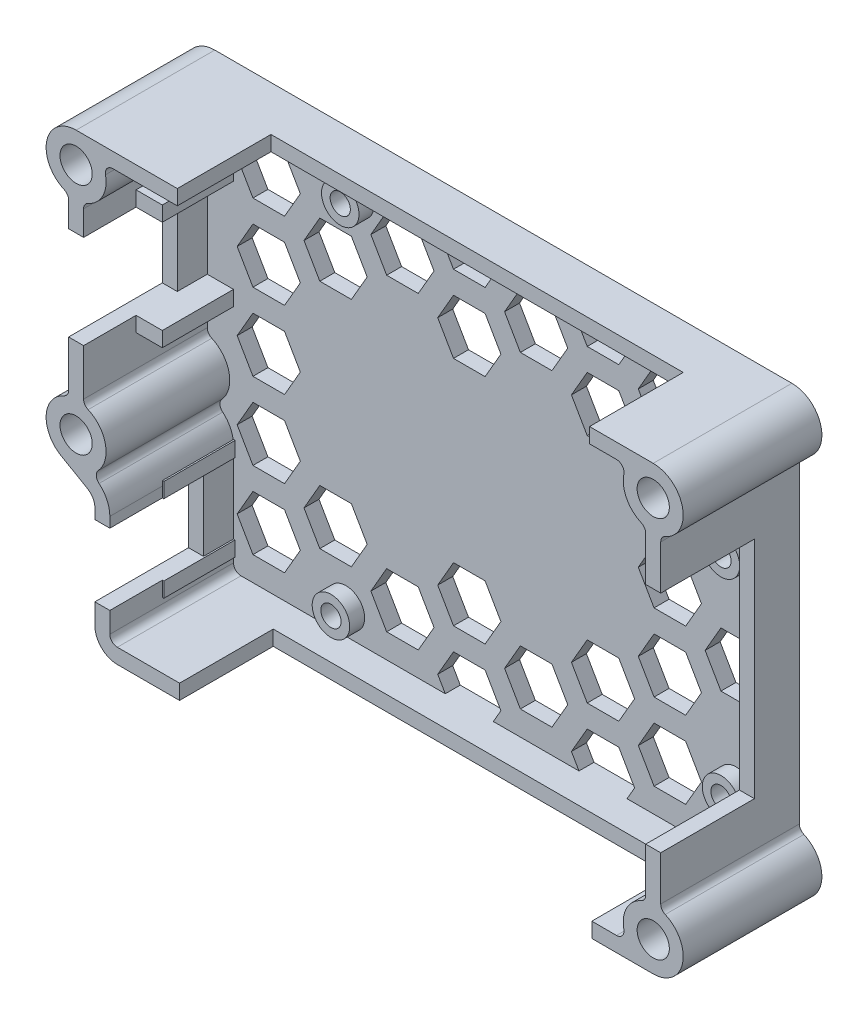
from build123d import *

# Parameters (mm, degrees)
ESQUISSE2_R             = 2.15
BOSS_EXTRU_1_DEPTH      = 2
ESQUISSE3_R             = 2.15
BOSS_EXTRU_2_DEPTH      = 16.5
ESQUISSE4_R             = 2.5
ESQUISSE4_R_2           = 1.35
BOSS_EXTRU_3_DEPTH      = 2
ESQUISSE6_W             = 2
ESQUISSE6_H             = 12.5
ESQUISSE6_H_2           = 9.5
ENL_V_MAT_EXTRU_1_DEPTH = 12.5
ESQUISSE7_W             = 3.5
ESQUISSE7_H             = 2
ESQUISSE7_W_2           = 0.2
BOSS_EXTRU_4_DEPTH      = 9.5
ENL_V_MAT_EXTRU_2_DEPTH = 55.333705929


with BuildPart() as part:
    # Esquisse2 → Boss.-Extru.1 (new body)
    with BuildSketch(Plane.XY):
        with BuildLine():
            ThreePointArc((-40.14, -1.999090834), (-42.533720464, -5.441104847), (-40.54, -9.129253005))
            Line((-40.54, -9.129253005), (-37.04, -11.149978947))
            ThreePointArc((-37.04, -11.149978947), (-36.307949192, -11.882029755), (-36.04, -12.882029755))
            Line((-36.04, -12.882029755), (-36.04, -26.5))
            ThreePointArc((-36.04, -26.5), (-35.161320344, -28.621320344), (-33.04, -29.5))
            Line((-33.04, -29.5), (38.46, -29.5))
            ThreePointArc((38.46, -29.5), (42.375625252, -26.317238575), (40.06, -21.833939444))
            ThreePointArc((40.06, -21.833939444), (39.623339973, -21.465146863), (39.46, -20.917424305))
            Line((39.46, -20.917424305), (39.46, 20.917424305))
            ThreePointArc((39.46, 20.917424305), (39.623339973, 21.465146863), (40.06, 21.833939444))
            ThreePointArc((40.06, 21.833939444), (42.375625252, 26.317238575), (38.46, 29.5))
            Line((38.46, 29.5), (-38.54, 29.5))
            ThreePointArc((-38.54, 29.5), (-42.455625252, 26.317238575), (-40.14, 21.833939444))
            ThreePointArc((-40.14, 21.833939444), (-39.703339973, 21.465146863), (-39.54, 20.917424305))
            Line((-39.54, 20.917424305), (-39.54, -1.082575695))
            ThreePointArc((-39.54, -1.082575695), (-39.703339973, -1.630298252), (-40.14, -1.999090834))
        make_face()
        with Locations((-38.54, -5.66515139)):
            Circle(ESQUISSE2_R, mode=Mode.SUBTRACT)
        with Locations((38.46, -25.5)):
            Circle(ESQUISSE2_R, mode=Mode.SUBTRACT)
        with Locations((-38.54, 25.5)):
            Circle(ESQUISSE2_R, mode=Mode.SUBTRACT)
        with Locations((38.46, 25.5)):
            Circle(ESQUISSE2_R, mode=Mode.SUBTRACT)
    extrude(amount=BOSS_EXTRU_1_DEPTH)

    # Esquisse3 → Boss.-Extru.2 (add)
    with BuildSketch(Plane.XY.offset(2)):
        with BuildLine():
            ThreePointArc((-40.14, 21.833939444), (-39.703339973, 21.465146863), (-39.54, 20.917424305))
            Line((-39.54, 20.917424305), (-39.54, -1.082575695))
            ThreePointArc((-39.54, -1.082575695), (-39.703339973, -1.630298252), (-40.14, -1.999090834))
            ThreePointArc((-40.14, -1.999090834), (-42.533720464, -5.441104847), (-40.54, -9.129253005))
            Line((-40.54, -9.129253005), (-37.04, -11.149978947))
            ThreePointArc((-37.04, -11.149978947), (-36.307949192, -11.882029755), (-36.04, -12.882029755))
            Line((-36.04, -12.882029755), (-36.04, -26.5))
            ThreePointArc((-36.04, -26.5), (-35.161320344, -28.621320344), (-33.04, -29.5))
            Line((-33.04, -29.5), (38.46, -29.5))
            ThreePointArc((38.46, -29.5), (42.375625252, -26.317238575), (40.06, -21.833939444))
            ThreePointArc((40.06, -21.833939444), (39.623339973, -21.465146863), (39.46, -20.917424305))
            Line((39.46, -20.917424305), (39.46, 20.917424305))
            ThreePointArc((39.46, 20.917424305), (39.623339973, 21.465146863), (40.06, 21.833939444))
            ThreePointArc((40.06, 21.833939444), (42.375625252, 26.317238575), (38.46, 29.5))
            Line((38.46, 29.5), (-38.54, 29.5))
            ThreePointArc((-38.54, 29.5), (-42.455625252, 26.317238575), (-40.14, 21.833939444))
        make_face()
        with Locations((-38.54, -5.66515139)):
            Circle(ESQUISSE3_R, mode=Mode.SUBTRACT)
        with Locations((38.46, -25.5)):
            Circle(ESQUISSE3_R, mode=Mode.SUBTRACT)
        with Locations((-38.54, 25.5)):
            Circle(ESQUISSE3_R, mode=Mode.SUBTRACT)
        with BuildLine():
            Line((-37.54, -1.082575695), (-37.54, 20.917424305))
            ThreePointArc((-37.54, 20.917424305), (-37.376660027, 21.465146863), (-36.94, 21.833939444))
            ThreePointArc((-36.94, 21.833939444), (-34.990102664, 23.656571426), (-34.620816412, 26.3))
            ThreePointArc((-34.620816412, 26.3), (-34.415617184, 27.132455532), (-33.641020514, 27.5))
            Line((-33.641020514, 27.5), (33.561020514, 27.5))
            ThreePointArc((33.561020514, 27.5), (34.335617184, 27.132455532), (34.540816412, 26.3))
            ThreePointArc((34.540816412, 26.3), (34.910102664, 23.656571426), (36.86, 21.833939444))
            ThreePointArc((36.86, 21.833939444), (37.296660027, 21.465146863), (37.46, 20.917424305))
            Line((37.46, 20.917424305), (37.46, -20.917424305))
            ThreePointArc((37.46, -20.917424305), (37.296660027, -21.465146863), (36.86, -21.833939444))
            ThreePointArc((36.86, -21.833939444), (34.910102664, -23.656571426), (34.540816412, -26.3))
            ThreePointArc((34.540816412, -26.3), (34.335617184, -27.132455532), (33.561020514, -27.5))
            Line((33.561020514, -27.5), (5.406709341, -27.5))
            Line((5.406709341, -27.5), (-33.04, -27.5))
            ThreePointArc((-33.04, -27.5), (-33.747106781, -27.207106781), (-34.04, -26.5))
            Line((-34.04, -26.5), (-34.04, -12.882029755))
            ThreePointArc((-34.04, -12.882029755), (-34.419216149, -11.182052019), (-35.484962152, -9.804403788))
            ThreePointArc((-35.484962152, -9.804403788), (-35.843811295, -9.104113647), (-35.584962152, -8.361028115))
            ThreePointArc((-35.584962152, -8.361028115), (-34.627755895, -4.83187709), (-36.94, -1.999090834))
            ThreePointArc((-36.94, -1.999090834), (-37.376660027, -1.630298252), (-37.54, -1.082575695))
        make_face(mode=Mode.SUBTRACT)
        with Locations((38.46, 25.5)):
            Circle(ESQUISSE3_R, mode=Mode.SUBTRACT)
    extrude(amount=BOSS_EXTRU_2_DEPTH)

    # Esquisse4 → Boss.-Extru.3 (add)
    # profile 1 of 4: a face of its own
    with BuildSketch(Plane.XY.offset(2)):
        with Locations((-17.8, 24.13)):
            Circle(ESQUISSE4_R)
        with Locations((-17.8, 24.13)):
            Circle(ESQUISSE4_R_2, mode=Mode.SUBTRACT)
    # profile 2 of 4: a face of its own
    with BuildSketch(Plane.XY.offset(2)):
        with Locations((-19.04, -24.13)):
            Circle(ESQUISSE4_R)
        with Locations((-19.04, -24.13)):
            Circle(ESQUISSE4_R_2, mode=Mode.SUBTRACT)
    # profile 3 of 4: a face of its own
    with BuildSketch(Plane.XY.offset(2)):
        with Locations((33, 8.89)):
            Circle(ESQUISSE4_R)
        with Locations((33, 8.89)):
            Circle(ESQUISSE4_R_2, mode=Mode.SUBTRACT)
    # profile 4 of 4: a face of its own
    with BuildSketch(Plane.XY.offset(2)):
        with Locations((33, -19.05)):
            Circle(ESQUISSE4_R)
        with Locations((33, -19.05)):
            Circle(ESQUISSE4_R_2, mode=Mode.SUBTRACT)
    extrude(amount=BOSS_EXTRU_3_DEPTH)

    # Esquisse6 → Enlèv. mat.-Extru.1 (cut)
    with BuildSketch(Plane.XY.offset(18.5)):
        Polygon((0.260510257, -27.5), (30.260510257, -27.5), (30.260510257, -29.5), (-24.739489743, -29.5), (-24.739489743, -27.5), align=None)
        with Locations((-38.54, 11.35)):
            Rectangle(ESQUISSE6_W, ESQUISSE6_H)
        with Locations((-35.04, -19)):
            Rectangle(ESQUISSE6_W, ESQUISSE6_H_2)
        Polygon((-0.04, 27.5), (-25.04, 27.5), (-25.04, 29.5), (29.96, 29.5), (29.96, 27.5), align=None)
        Polygon((39.46, 0), (39.46, 15), (37.46, 15), (37.46, -15), (39.46, -15), align=None)
    extrude(amount=-ENL_V_MAT_EXTRU_1_DEPTH, mode=Mode.SUBTRACT)

    # Esquisse7 → Boss.-Extru.4 (add)
    with BuildSketch(Plane.XY.offset(2)):
        with Locations((-35.79, 18.6)):
            Rectangle(ESQUISSE7_W, ESQUISSE7_H)
        with Locations((-35.79, 4.1)):
            Rectangle(ESQUISSE7_W, ESQUISSE7_H)
        with Locations((-33.94, -13.25)):
            Rectangle(ESQUISSE7_W_2, ESQUISSE7_H)
        with Locations((-33.94, -24.75)):
            Rectangle(ESQUISSE7_W_2, ESQUISSE7_H)
    extrude(amount=BOSS_EXTRU_4_DEPTH)

    # Esquisse9 → Enlèv. mat.-Extru.2 (cut, through all)
    with BuildSketch(Plane.XY.offset(2)):
        Polygon((-27.232794835, -16.95), (-31.447451801, -16.95), (-33.554780283, -20.6), (-31.447451801, -24.25), (-27.232794835, -24.25), (-25.125466353, -20.6), align=None)
        Polygon((-22.527390142, -19.1), (-18.312733176, -19.1), (-16.205404694, -15.45), (-18.312733176, -11.8), (-22.527390142, -11.8), (-24.634718624, -15.45), align=None)
        Polygon((-13.607328483, -16.95), (-15.714656965, -20.6), (-13.607328483, -24.25), (-9.392671517, -24.25), (-7.285343035, -20.6), (-9.392671517, -16.95), align=None)
        Polygon((-27.232794835, -13.95), (-25.125466353, -10.3), (-27.232794835, -6.65), (-31.447451801, -6.65), (-33.554780283, -10.3), (-31.447451801, -13.95), align=None)
        Polygon((-27.232794835, -3.65), (-25.125466353, 0), (-27.232794835, 3.65), (-31.447451801, 3.65), (-33.554780283, 0), (-31.447451801, -3.65), align=None)
        Polygon((-27.232794835, 6.65), (-25.125466353, 10.3), (-27.232794835, 13.95), (-31.447451801, 13.95), (-33.554780283, 10.3), (-31.447451801, 6.65), align=None)
        Polygon((-27.232794835, 16.95), (-25.125466353, 20.6), (-27.232794835, 24.25), (-31.447451801, 24.25), (-33.554780283, 20.6), (-31.447451801, 16.95), align=None)
        Polygon((-22.527390142, 19.1), (-24.634718624, 15.45), (-22.527390142, 11.8), (-18.312733176, 11.8), (-16.205404694, 15.45), (-18.312733176, 19.1), align=None)
        Polygon((-15.714656965, 20.6), (-13.607328483, 16.95), (-9.392671517, 16.95), (-7.285343035, 20.6), (-9.392671517, 24.25), (-13.607328483, 24.25), align=None)
        Polygon((-4.687266824, 19.1), (-6.794595306, 15.45), (-4.687266824, 11.8), (-0.472609858, 11.8), (1.634718624, 15.45), (-0.472609858, 19.1), align=None)
        Polygon((2.125466353, 20.6), (4.232794835, 16.95), (8.447451801, 16.95), (10.554780283, 20.6), (8.447451801, 24.25), (4.232794835, 24.25), align=None)
        Polygon((13.152856494, 19.1), (11.045528012, 15.45), (13.152856494, 11.8), (17.367513459, 11.8), (19.474841942, 15.45), (17.367513459, 19.1), align=None)
        Polygon((-6.794595306, -15.45), (-4.687266824, -19.1), (-0.472609858, -19.1), (1.634718624, -15.45), (-0.472609858, -11.8), (-4.687266824, -11.8), align=None)
        Polygon((2.125466353, -20.6), (4.232794835, -24.25), (8.447451801, -24.25), (10.554780283, -20.6), (8.447451801, -16.95), (4.232794835, -16.95), align=None)
        Polygon((19.965589671, -20.6), (22.072918153, -24.25), (26.287575118, -24.25), (28.394903601, -20.6), (26.287575118, -16.95), (22.072918153, -16.95), align=None)
        Polygon((17.367513459, -19.1), (19.474841942, -15.45), (17.367513459, -11.8), (13.152856494, -11.8), (11.045528012, -15.45), (13.152856494, -19.1), align=None)
        Polygon((22.072918153, -13.95), (26.287575118, -13.95), (28.394903601, -10.3), (26.287575118, -6.65), (22.072918153, -6.65), (19.965589671, -10.3), align=None)
        Polygon((19.965589671, 20.6), (22.072918153, 16.95), (26.287575118, 16.95), (28.394903601, 20.6), (26.287575118, 24.25), (22.072918153, 24.25), align=None)
        Polygon((22.072918153, 13.95), (19.965589671, 10.3), (22.072918153, 6.65), (26.287575118, 6.65), (28.394903601, 10.3), (26.287575118, 13.95), align=None)
        Polygon((22.072918153, 3.65), (19.965589671, 0), (22.072918153, -3.65), (26.287575118, -3.65), (28.394903601, 0), (26.287575118, 3.65), align=None)
        Polygon((30.992979812, -8.8), (35.207636777, -8.8), (37.31496526, -5.15), (35.207636777, -1.5), (30.992979812, -1.5), (28.88565133, -5.15), align=None)
        Polygon((0.624355653, -27.5), (-5.784232335, -27.5), (-6.794595306, -25.75), (-4.687266824, -22.1), (-0.472609858, -22.1), (1.634718624, -25.75), align=None)
        Polygon((12.055890983, -27.5), (18.464478971, -27.5), (19.474841942, -25.75), (17.367513459, -22.1), (13.152856494, -22.1), (11.045528012, -25.75), align=None)
        Polygon((-6.794595306, 25.75), (-4.687266824, 22.1), (-0.472609858, 22.1), (1.634718624, 25.75), (0.624355653, 27.5), (-5.784232335, 27.5), align=None)
        Polygon((12.055890983, 27.5), (18.464478971, 27.5), (19.474841942, 25.75), (17.367513459, 22.1), (13.152856494, 22.1), (11.045528012, 25.75), align=None)
    extrude(amount=-ENL_V_MAT_EXTRU_2_DEPTH, mode=Mode.SUBTRACT)


solid = part.part
